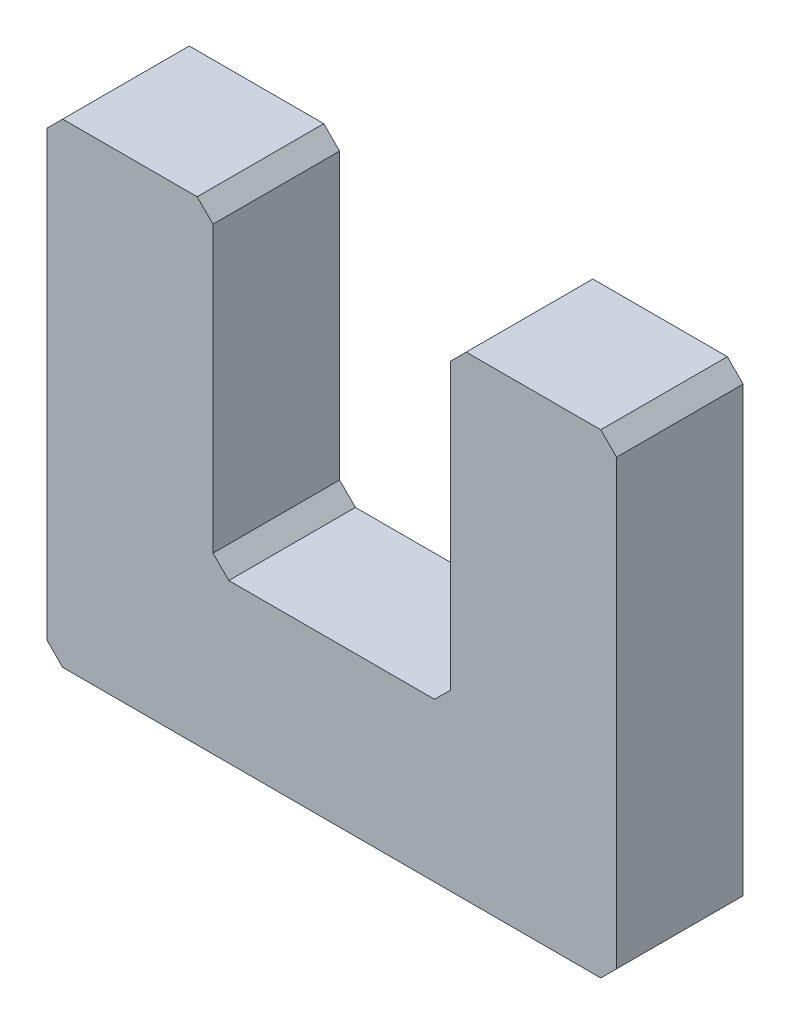
from build123d import *

# Parameters (mm, degrees)
SKETCH_1_W          = 36
SKETCH_1_H          = 30
EXTRUDE_1_DEPTH     = 8
CUT_EXTRUDE_1_REACH = 26.759
SKETCH_9_W          = 15
SKETCH_9_H          = 20
CHAMFER_1_SIZE      = 1
CHAMFER_2_SIZE      = 1
CHAMFER_3_SIZE      = 1


with BuildPart() as part:
    # 草图1 → 凸台-拉伸1 (new body)
    with BuildSketch(Plane.XY):
        Rectangle(SKETCH_1_W, SKETCH_1_H)
    extrude(amount=EXTRUDE_1_DEPTH)

    # 草图9 → 切除-拉伸1 (cut, up to next)
    with BuildSketch(Plane.XY.offset(8), mode=Mode.PRIVATE) as cut_extrude_1_sk1:
        with Locations((0, 5)):
            Rectangle(SKETCH_9_W, SKETCH_9_H)
    cut_extrude_1_tool1 = extrude(cut_extrude_1_sk1.sketch, amount=-CUT_EXTRUDE_1_REACH, mode=Mode.PRIVATE) & part.part
    add(cut_extrude_1_tool1.solids().sort_by_distance((0, 5, 8))[0], mode=Mode.SUBTRACT)

    # 倒角1
    chamfer_1_edges = [part.edges().sort_by_distance(p)[0] for p in [
        (18, -15, 4),
        (-18, -15, 4),
        (-18, 15, 4),
        (18, 15, 4),
    ]]
    chamfer(chamfer_1_edges, length=CHAMFER_1_SIZE)

    # 倒角2
    chamfer_2_edges = [part.edges().sort_by_distance(p)[0] for p in [
        (-7.5, 15, 4),
        (7.5, 15, 4),
    ]]
    chamfer(chamfer_2_edges, length=CHAMFER_2_SIZE)

    # 倒角3
    chamfer_3_edges = [part.edges().sort_by_distance(p)[0] for p in [
        (7.5, -5, 4),
        (-7.5, -5, 4),
    ]]
    chamfer(chamfer_3_edges, length=CHAMFER_3_SIZE)


solid = part.part
